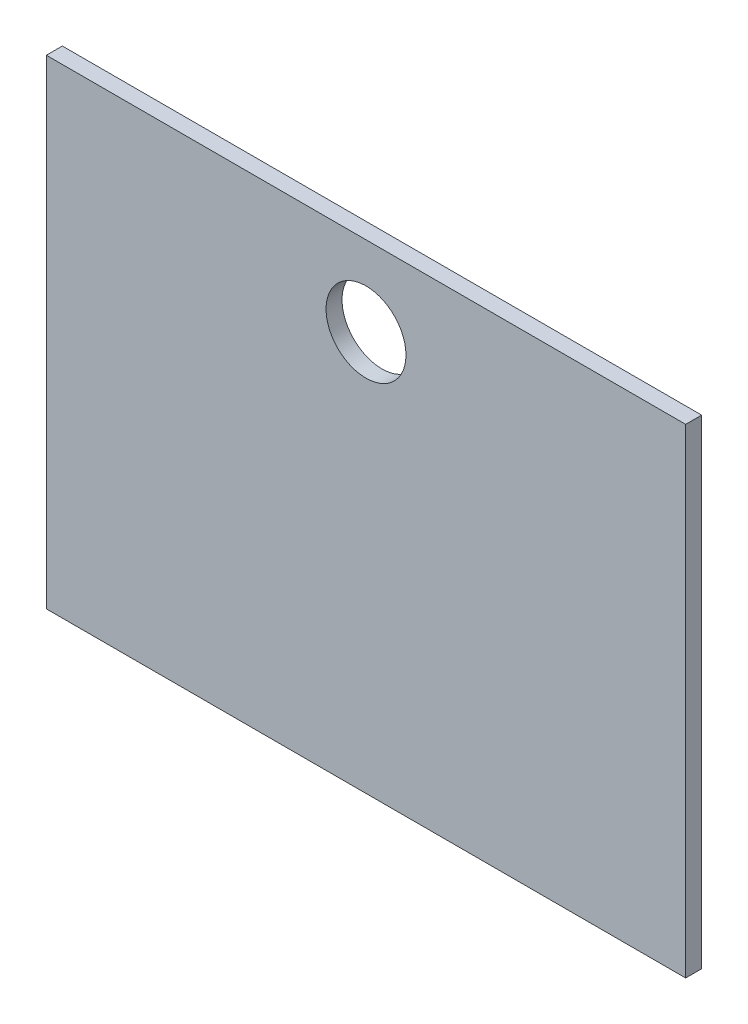
from build123d import *

# Parameters (mm, degrees)
SKETCH_1_W          = 80
SKETCH_1_H          = 20
EXTRUDE_1_DEPTH     = 2
SKETCH_2_R          = 5
CUT_EXTRUDE_1_DEPTH = 42.279534881
SKETCH_3_W          = 80
SKETCH_3_H          = 2
EXTRUDE_2_DEPTH     = 40


with BuildPart() as part:
    # Эскиз1 → Бобышка-Вытянуть1 (new body)
    with BuildSketch(Plane.XY):
        Rectangle(SKETCH_1_W, SKETCH_1_H)
    extrude(amount=EXTRUDE_1_DEPTH)

    # Эскиз2 → Вырез-Вытянуть1 (cut, through all)
    with BuildSketch(Plane.XY.offset(2)):
        Circle(SKETCH_2_R)
    extrude(amount=-CUT_EXTRUDE_1_DEPTH, mode=Mode.SUBTRACT)

    # Эскиз3 → Бобышка-Вытянуть2 (add)
    with BuildSketch(Plane.XZ.offset(10)):
        with Locations((0, 1)):
            Rectangle(SKETCH_3_W, SKETCH_3_H)
    extrude(amount=EXTRUDE_2_DEPTH)


solid = part.part
